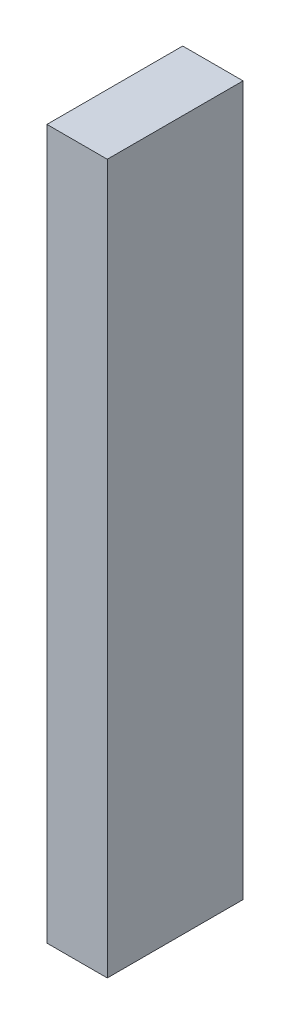
from build123d import *

# Parameters (mm, degrees)
SKETCH1_W           = 12.7
SKETCH1_H           = 149.225
BOSS_EXTRUDE1_DEPTH = 28.575
HOLE1_D             = 3.175
HOLE1_DEPTH         = 38.1
HOLE1_CSINK_D       = 10.16
HOLE1_CSINK_ANGLE   = 82
HOLE1_TIP           = 0.953866233


with BuildPart() as part:
    # Sketch1 → Boss-Extrude1 (new body)
    with BuildSketch(Plane.XY):
        with Locations((-120.138766336, -385.7625)):
            Rectangle(SKETCH1_W, SKETCH1_H)
    extrude(amount=BOSS_EXTRUDE1_DEPTH)

    # Hole1
    with Locations(Plane(origin=(0, 0, -25.4), x_dir=(-1, 0, 0), z_dir=(0, 0, -1))):
        with Locations((-75.688766336, -9.525), (218.563766336, -31.75), (218.563766336, -218.821), (218.563766336, -418.592), (104.263766336, -19.05), (104.263766336, -149.225), (104.263766336, -279.4), (120.138766336, -330.2), (120.138766336, -444.5), (-120.138766336, -444.5), (-120.138766336, -330.2), (-104.263766336, -279.4), (-104.263766336, -149.225), (-104.263766336, -19.05), (-218.563766336, -418.592), (-218.563766336, -218.821), (-218.563766336, -31.75), (0, -304.8), (107.438766336, -304.8), (-107.438766336, -304.8), (75.688766336, -276.225), (0, -276.225), (-75.688766336, -276.225), (75.688766336, -9.525), (0, -9.525)):
            CounterSinkHole(HOLE1_D / 2, HOLE1_CSINK_D / 2, depth=HOLE1_DEPTH, counter_sink_angle=HOLE1_CSINK_ANGLE)
            with Locations((0, 0, -(HOLE1_DEPTH + HOLE1_TIP / 2))):  # 118° drill point
                Cone(0, HOLE1_D / 2, HOLE1_TIP, mode=Mode.SUBTRACT)


solid = part.part
